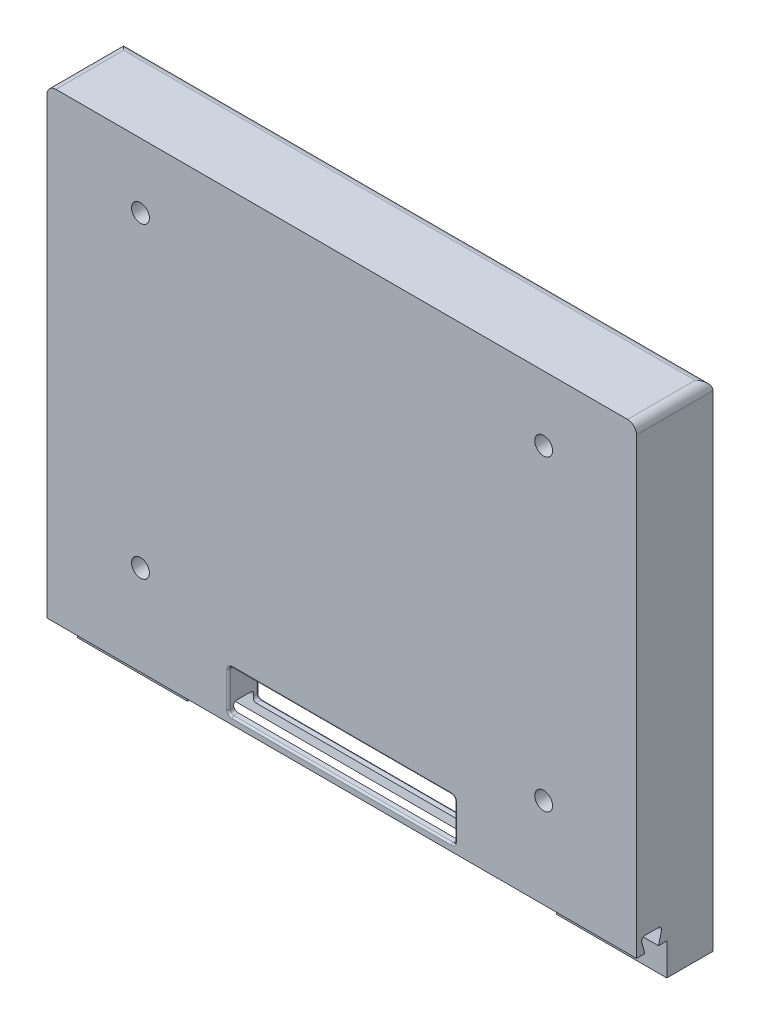
from build123d import *

# Parameters (mm, degrees)
SKETCH1_W           = 165.1
SKETCH1_H           = 100
BOSS_EXTRUDE1_DEPTH = 5
SKETCH4_W           = 165.1
SKETCH4_H           = 100
BOSS_EXTRUDE2_DEPTH = 3.5
SKETCH10_W          = 165.1
SKETCH10_H          = 8.5
BOSS_EXTRUDE4_DEPTH = 17
SKETCH11_W          = 103.4
SKETCH11_H          = 90.9
CUT_EXTRUDE6_DEPTH  = 6
SKETCH12_W          = 165.1
SKETCH12_H          = 13.05
BOSS_EXTRUDE5_DEPTH = 12.95
SKETCH13_W          = 165.1
SKETCH13_H          = 21.45
BOSS_EXTRUDE6_DEPTH = 9.75
SKETCH14_W          = 30.85
SKETCH14_H          = 115.7
BOSS_EXTRUDE7_DEPTH = 12.95
SKETCH15_R          = 1.35
CUT_EXTRUDE7_DEPTH  = 8.65
SKETCH16_R          = 2.5
CUT_EXTRUDE8_DEPTH  = 146.84584686
FILLET1_R           = 2.5
SKETCH17_W          = 165.1
SKETCH17_H          = 8.5
BOSS_EXTRUDE9_DEPTH = 2.75
CUT_EXTRUDE9_DEPTH  = 205.50252088
SKETCH21_R          = 1.35
CUT_EXTRUDE10_DEPTH = 17.5
SKETCH22_W          = 63.4
SKETCH22_H          = 11.8
CUT_EXTRUDE11_DEPTH = 10
FILLET2_R           = 1
FILLET3_R           = 0.5


with BuildPart() as part:
    # Sketch1 → Boss-Extrude1 (new body)
    with BuildSketch(Plane.XY):
        with Locations((0, -40.801949153)):
            Rectangle(SKETCH1_W, SKETCH1_H)
    extrude(amount=BOSS_EXTRUDE1_DEPTH)

    # Sketch4 → Boss-Extrude2 (add)
    with BuildSketch(Plane(origin=(0, 0, 0), x_dir=(-1, 0, 0), z_dir=(0, 0, -1))):
        with Locations((0, -40.801949153)):
            Rectangle(SKETCH4_W, SKETCH4_H)
    extrude(amount=BOSS_EXTRUDE2_DEPTH)

    # Sketch10 → Boss-Extrude4 (add)
    with BuildSketch(Plane.XZ.offset(90.801949153)):
        with Locations((0, 0.75)):
            Rectangle(SKETCH10_W, SKETCH10_H)
    extrude(amount=BOSS_EXTRUDE4_DEPTH)

    # Sketch11 → Cut-Extrude6 (cut)
    with BuildSketch(Plane(origin=(0, 0, -3.5), x_dir=(-1, 0, 0), z_dir=(0, 0, -1))):
        with Locations((0, -49.301949153)):
            Rectangle(SKETCH11_W, SKETCH11_H)
    extrude(amount=-CUT_EXTRUDE6_DEPTH, mode=Mode.SUBTRACT)

    # Sketch12 → Boss-Extrude5 (add)
    with BuildSketch(Plane(origin=(0, 0, -3.5), x_dir=(-1, 0, 0), z_dir=(0, 0, -1))):
        with Locations((0, 2.673050847)):
            Rectangle(SKETCH12_W, SKETCH12_H)
    extrude(amount=BOSS_EXTRUDE5_DEPTH)

    # Sketch13 → Boss-Extrude6 (add)
    with BuildSketch(Plane(origin=(0, 9.198050847, 0), x_dir=(1, 0, 0), z_dir=(0, 1, 0))):
        with Locations((0, 5.725)):
            Rectangle(SKETCH13_W, SKETCH13_H)
    extrude(amount=BOSS_EXTRUDE6_DEPTH)

    # Sketch14 → Boss-Extrude7 (add)
    with BuildSketch(Plane(origin=(0, 0, -3.5), x_dir=(-1, 0, 0), z_dir=(0, 0, -1))):
        Polygon((-51.7, -106.501949153), (-51.7, -119.551949153), (-82.55, -119.551949153), (-82.55, -3.851949153), (-51.7, -3.851949153), align=None)
        with Locations((67.125, -61.701949153)):
            Rectangle(SKETCH14_W, SKETCH14_H)
    extrude(amount=BOSS_EXTRUDE7_DEPTH)

    # Sketch15 → Cut-Extrude7 (cut)
    with BuildSketch(Plane(origin=(0, 0, -16.45), x_dir=(-1, 0, 0), z_dir=(0, 0, -1))):
        with Locations((56.3625, -85.271949153)):
            Circle(SKETCH15_R)
        with Locations((56.3625, 0.810550847)):
            Circle(SKETCH15_R)
        with Locations((-56.5625, 0.810550847)):
            Circle(SKETCH15_R)
        with Locations((-56.5625, -85.271949153)):
            Circle(SKETCH15_R)
    extrude(amount=-CUT_EXTRUDE7_DEPTH, mode=Mode.SUBTRACT)

    # Sketch16 → Cut-Extrude8 (cut, through all)
    with BuildSketch(Plane(origin=(0, 0, -7.8), x_dir=(-1, 0, 0), z_dir=(0, 0, -1))):
        with Locations((56.3625, 0.810550847)):
            Circle(SKETCH16_R)
        with Locations((-56.5625, 0.810550847)):
            Circle(SKETCH16_R)
        with Locations((-56.5625, -85.271949153)):
            Circle(SKETCH16_R)
        with Locations((56.3625, -85.271949153)):
            Circle(SKETCH16_R)
    extrude(amount=-CUT_EXTRUDE8_DEPTH, mode=Mode.SUBTRACT)

    # Fillet1
    fillet1_edges = [part.edges().sort_by_distance(p)[0] for p in [
        (-82.55, 18.948050847, -5.725),
        (82.55, 18.948050847, -5.725),
        (0, 18.948050847, -16.45),
    ]]
    fillet(fillet1_edges, radius=FILLET1_R)

    # Sketch17 → Boss-Extrude9 (add)
    with BuildSketch(Plane.XZ.offset(107.801949153)):
        with Locations((0, 0.75)):
            Rectangle(SKETCH17_W, SKETCH17_H)
    extrude(amount=BOSS_EXTRUDE9_DEPTH)

    # Sketch20 → Cut-Extrude9 (cut, through all)
    with BuildSketch(Plane(origin=(82.55, 0, 0), x_dir=(0, 0, -1), z_dir=(1, 0, 0))):
        with BuildLine():
            Line((1.155291427, -110.551949153), (2.030698282, -107.284886293))
            ThreePointArc((2.030698282, -107.284886293), (1.875383044, -106.504063866), (1.161365038, -106.151949153))
            Line((1.161365038, -106.151949153), (-2.661365038, -106.151949153))
            ThreePointArc((-2.661365038, -106.151949153), (-3.375383044, -106.504063866), (-3.530698282, -107.284886293))
            Line((-3.530698282, -107.284886293), (-2.655291427, -110.551949153))
            Line((-2.655291427, -110.551949153), (1.155291427, -110.551949153))
        make_face()
    extrude(amount=-CUT_EXTRUDE9_DEPTH, mode=Mode.SUBTRACT)

    # Sketch21 → Cut-Extrude10 (cut)
    with BuildSketch(Plane.XZ.offset(119.551949153)):
        with Locations(Location((-67.125, -9.975, 0), (0, 0, 270))):
            Circle(SKETCH21_R)
        with Locations(Location((67.125, -9.975, 0), (0, 0, 270))):
            Circle(SKETCH21_R)
    extrude(amount=-CUT_EXTRUDE10_DEPTH, mode=Mode.SUBTRACT)

    # Sketch22 → Cut-Extrude11 (cut)
    with BuildSketch(Plane(origin=(0, 0, -3.5), x_dir=(-1, 0, 0), z_dir=(0, 0, -1))):
        with Locations((0, -102.651949153)):
            Rectangle(SKETCH22_W, SKETCH22_H)
    extrude(amount=-CUT_EXTRUDE11_DEPTH, mode=Mode.SUBTRACT)

    # Fillet2
    fillet2_edges = [part.edges().sort_by_distance(p)[0] for p in [
        (31.7, -96.751949153, 0.75),
        (-31.7, -108.551949153, 4.095594906),
        (-31.7, -108.551949153, -2.595594906),
        (31.7, -108.551949153, 4.095594906),
        (31.7, -108.551949153, -2.595594906),
        (-31.7, -96.751949153, 0.75),
    ]]
    fillet(fillet2_edges, radius=FILLET2_R)

    # Fillet3
    fillet3_edges = [part.edges().sort_by_distance(p)[0] for p in [
        (31.407106781, -108.259055934, 5),
        (31.7, -102.651949153, 5),
        (31.407106781, -97.044842371, 5),
        (31.407106781, -97.044842371, -3.5),
        (0, -96.751949153, 5),
        (0, -96.751949153, -3.5),
        (-31.407106781, -97.044842371, 5),
        (-31.407106781, -97.044842371, -3.5),
        (-31.7, -102.651949153, 5),
        (-31.407106781, -108.259055934, 5),
        (0, -108.551949153, 5),
        (-31.407106781, -108.259055934, -3.5),
        (31.407106781, -108.259055934, -3.5),
    ]]
    fillet(fillet3_edges, radius=FILLET3_R)


solid = part.part
